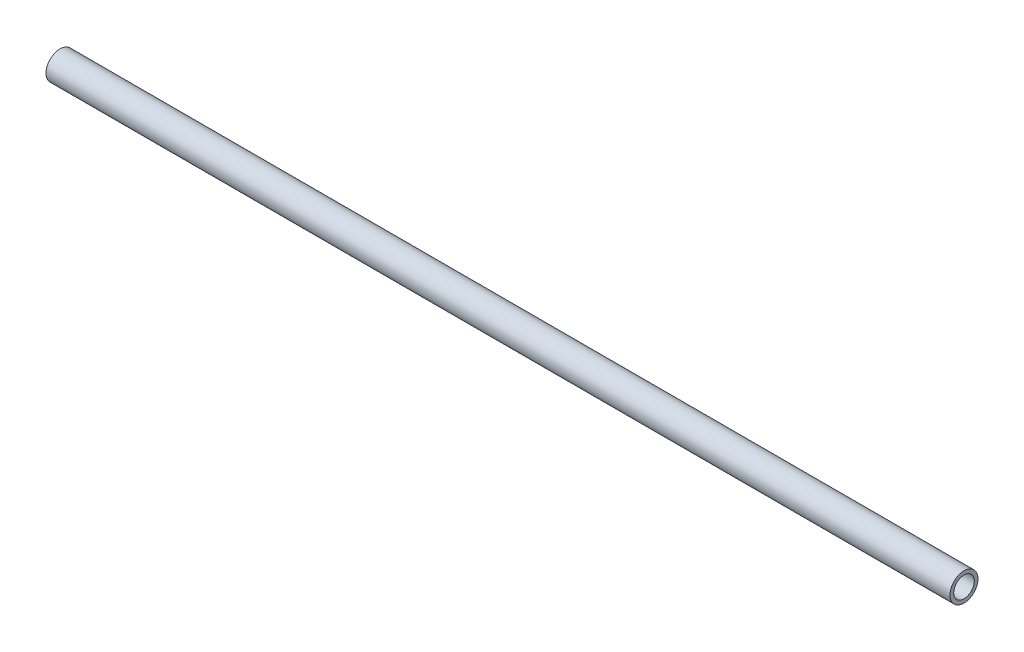
from build123d import *

# Parameters (mm, degrees)
AXIAL_PROFILE_MM_W = 145
AXIAL_PROFILE_MM_H = 0.6


with BuildPart() as part:
    # Axial profile (mm) → Full revolution (revolve)
    with BuildSketch(Plane.XY, mode=Mode.PRIVATE) as full_revolution_sk:
        with Locations((86.2, 1.95)):
            Rectangle(AXIAL_PROFILE_MM_W, AXIAL_PROFILE_MM_H)
    revolve(full_revolution_sk.sketch.rotate(Axis((-110, 0, 0), (1, 0, 0)), 90), axis=Axis((-110, 0, 0), (1, 0, 0)))


solid = part.part
